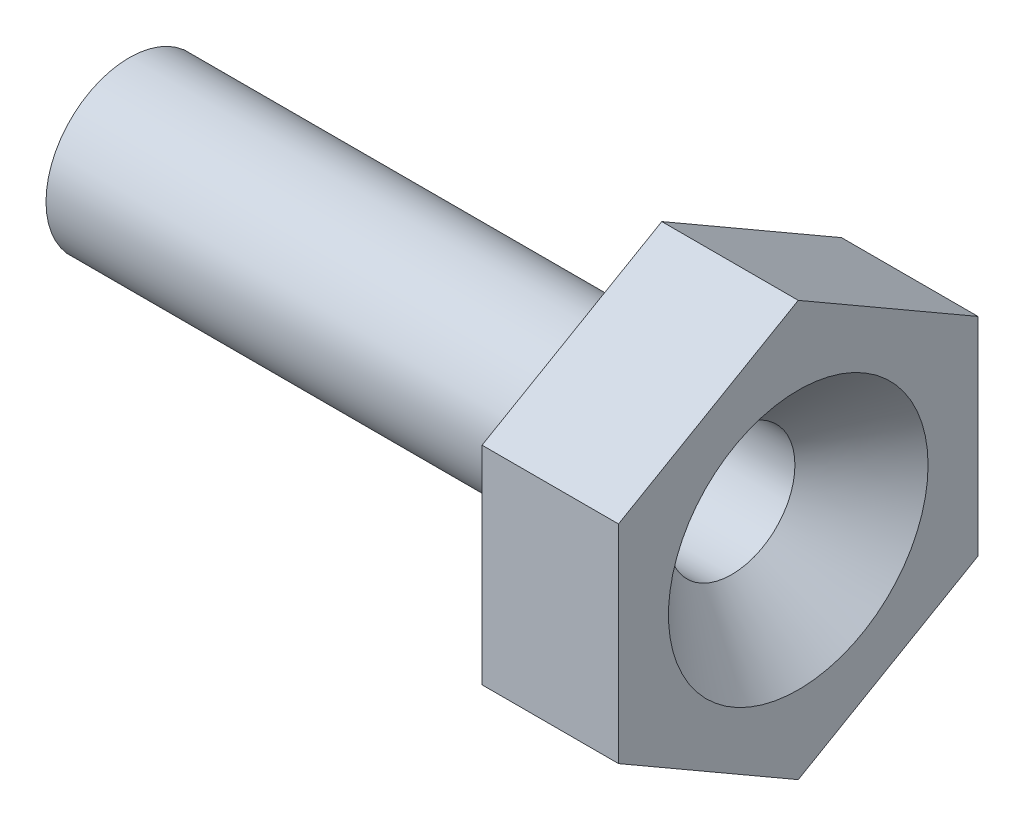
from build123d import *

# Parameters (mm, degrees)
BOSS_EXTRUDE1_DEPTH = 2.05
SKETCH2_R           = 1.25
BOSS_EXTRUDE2_DEPTH = 8
SKETCH3_R           = 0.95
CUT_EXTRUDE1_DEPTH  = 11.863355835
CHAMFER1_SIZE       = 1


with BuildPart() as part:
    # Sketch1 → Boss-Extrude1 (new body)
    with BuildSketch(Plane(origin=(0, 0, 0), x_dir=(0, 0, -1), z_dir=(1, 0, 0))):
        Polygon((0, -3.117691454), (2.7, -1.558845727), (2.7, 1.558845727), (0, 3.117691454), (-2.7, 1.558845727), (-2.7, -1.558845727), align=None)
    extrude(amount=BOSS_EXTRUDE1_DEPTH)

    # Sketch2 → Boss-Extrude2 (add)
    with BuildSketch(Plane.ZY):
        with Locations(Location((0, 0, 0), (0, 0, 180))):
            Circle(SKETCH2_R)
    extrude(amount=BOSS_EXTRUDE2_DEPTH)

    # Sketch3 → Cut-Extrude1 (cut, through all)
    with BuildSketch(Plane.ZY.offset(8)):
        Circle(SKETCH3_R)
    extrude(amount=-CUT_EXTRUDE1_DEPTH, mode=Mode.SUBTRACT)

    # Chamfer1
    chamfer1_edges = [part.edges().sort_by_distance(p)[0] for p in [
        (2.05, 0, -0.95),
    ]]
    chamfer(chamfer1_edges, length=CHAMFER1_SIZE)


solid = part.part
